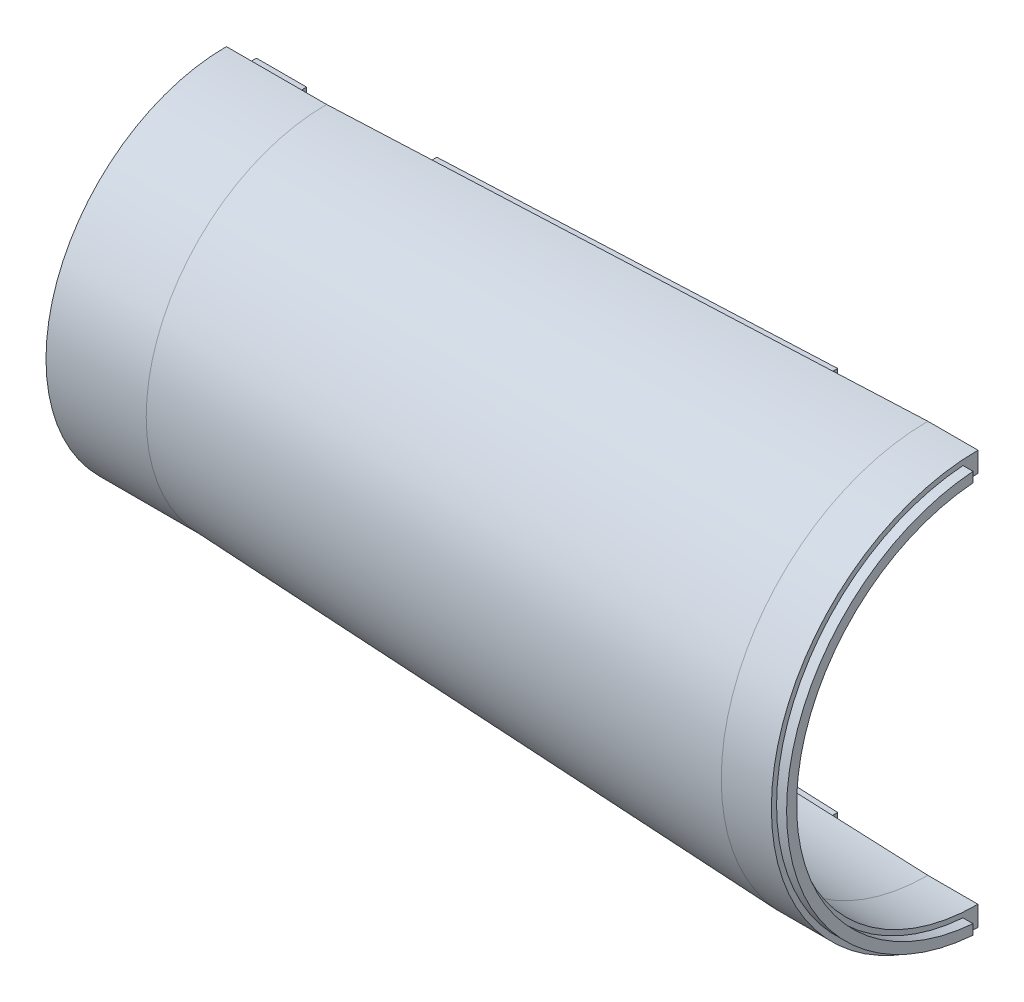
from build123d import *

# Parameters (mm, degrees)
REVOLVE2_ANGLE      = 180
SKETCH4_W           = 20.32
SKETCH4_H           = 20.32
CUT_EXTRUDE2_DEPTH  = 32.004
SKETCH5_W           = 2.54
SKETCH5_H           = 12.7
SKETCH5_W_2         = 12.7
SKETCH5_H_2         = 2.54
BOSS_EXTRUDE1_DEPTH = 2.54
BOSS_EXTRUDE2_DEPTH = 2.54


with BuildPart() as part:
    # Sketch2 → Revolve2 (revolve)
    with BuildSketch(Plane.XY):
        Polygon((0, 0), (0, 40.64), (0, 45.72), (25.4, 45.72), (177.8, 52.373927699), (190.5, 52.373927699), (190.5, 47.293927699), (177.8, 47.293927699), (25.4, 40.64), (5.08, 40.64), (5.08, 0), align=None)
    revolve(axis=Axis((0, 0, 0), (1, 0, 0)), revolution_arc=REVOLVE2_ANGLE)

    # Sketch4 → Cut-Extrude2 (cut)
    with BuildSketch(Plane.ZY):
        with Locations((10.16, 10.16)):
            Rectangle(SKETCH4_W, SKETCH4_H)
        with Locations((10.16, -10.16)):
            Rectangle(SKETCH4_W, SKETCH4_H)
    extrude(amount=-CUT_EXTRUDE2_DEPTH, mode=Mode.SUBTRACT)

    # Sketch5 → Boss-Extrude1 (add)
    with BuildSketch(Plane(origin=(0, 0, 0), x_dir=(-1, 0, 0), z_dir=(0, 0, -1))):
        with Locations((-2.54, 34.29)):
            Rectangle(SKETCH5_W, SKETCH5_H)
        Polygon((-152.4, 49.994939749), (-152.4, 47.454939749), (-50.8, 43.01898795), (-50.8, 45.55898795), align=None)
        with Locations((-11.43, 43.18)):
            Rectangle(SKETCH5_W_2, SKETCH5_H_2)
        Polygon((-50.8, -43.01898795), (-50.8, -45.55898795), (-152.4, -49.994939749), (-152.4, -47.454939749), align=None)
        with Locations((-11.43, -43.18)):
            Rectangle(SKETCH5_W_2, SKETCH5_H_2)
        with Locations((-2.54, -34.29)):
            Rectangle(SKETCH5_W, SKETCH5_H)
    extrude(amount=BOSS_EXTRUDE1_DEPTH)

    # Sketch6 → Boss-Extrude2 (add)
    with BuildSketch(Plane(origin=(190.5, 0, 0), x_dir=(0, 0, -1), z_dir=(1, 0, 0))):
        with BuildLine():
            Line((-3.81, 50.911637334), (-3.81, 48.371637334))
            ThreePointArc((-3.81, 48.371637334), (-48.52145297, 0), (-3.81, -48.371637334))
            Line((-3.81, -48.371637334), (-3.81, -50.911637334))
            ThreePointArc((-3.81, -50.911637334), (-51.054, 0), (-3.81, 50.911637334))
        make_face()
    extrude(amount=BOSS_EXTRUDE2_DEPTH)


solid = part.part
